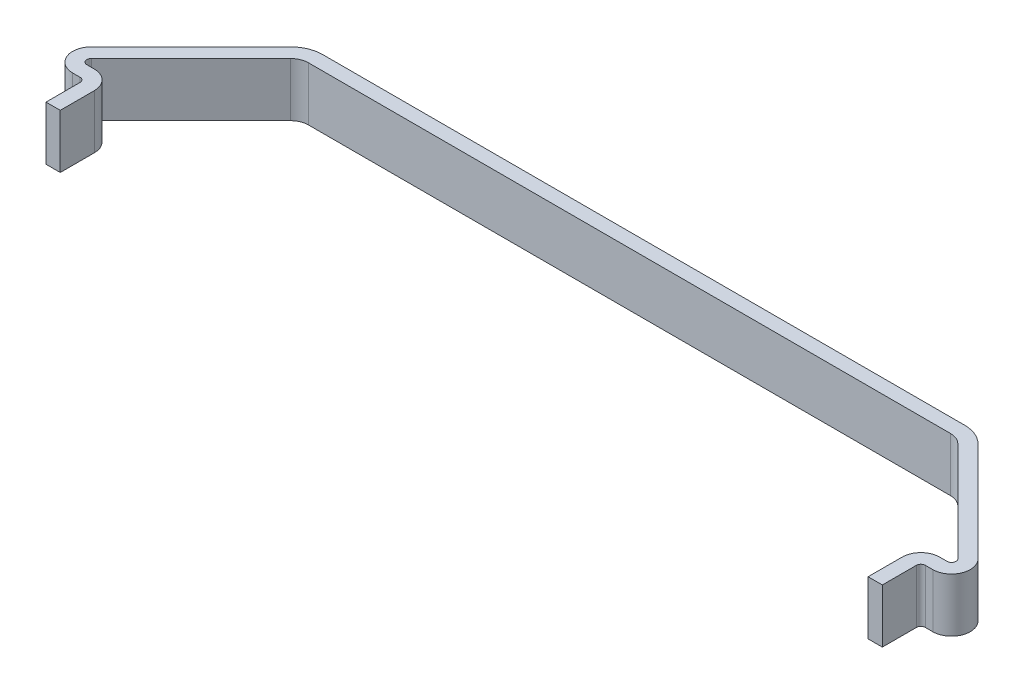
from build123d import *

# Parameters (mm, degrees)
BOSS_EXTRUDE1_DEPTH = 1.5


with BuildPart() as part:
    # Sketch1 → Boss-Extrude1 (new, symmetric)
    with BuildSketch(Plane(origin=(0, 0, 0), x_dir=(1, 0, 0), z_dir=(0, 1, 0))):
        with BuildLine():
            Line((17.879536438, 11.70625), (-17.879536438, 11.70625))
            ThreePointArc((-17.879536438, 11.70625), (-18.26221987, 11.630129533), (-18.586643219, 11.413356781))
            Line((-18.586643219, 11.413356781), (-24.133026695, 5.866973305))
            ThreePointArc((-24.133026695, 5.866973305), (-24.187219883, 5.594525751), (-23.95625, 5.440196609))
            Line((-23.95625, 5.440196609), (-23.54375, 5.440196609))
            ThreePointArc((-23.54375, 5.440196609), (-22.805707297, 5.134489312), (-22.5, 4.396446609))
            Line((-22.5, 4.396446609), (-22.5, 2.5))
            Line((-22.5, 2.5), (-23.29375, 2.5))
            Line((-23.29375, 2.5), (-23.29375, 4.396446609))
            ThreePointArc((-23.29375, 4.396446609), (-23.366973305, 4.573223305), (-23.54375, 4.646446609))
            Line((-23.54375, 4.646446609), (-23.95625, 4.646446609))
            ThreePointArc((-23.95625, 4.646446609), (-24.920549262, 5.290770777), (-24.694292703, 6.428239312))
            Line((-24.694292703, 6.428239312), (-19.147909226, 11.974622789))
            ThreePointArc((-19.147909226, 11.974622789), (-18.565974844, 12.363458911), (-17.879536438, 12.5))
            Line((-17.879536438, 12.5), (17.879536438, 12.5))
            ThreePointArc((17.879536438, 12.5), (18.565974844, 12.363458911), (19.147909226, 11.974622789))
            Line((19.147909226, 11.974622789), (24.694292703, 6.428239312))
            ThreePointArc((24.694292703, 6.428239312), (24.920549262, 5.290770777), (23.95625, 4.646446609))
            Line((23.95625, 4.646446609), (23.54375, 4.646446609))
            ThreePointArc((23.54375, 4.646446609), (23.366973305, 4.573223305), (23.29375, 4.396446609))
            Line((23.29375, 4.396446609), (23.29375, 2.5))
            Line((23.29375, 2.5), (22.5, 2.5))
            Line((22.5, 2.5), (22.5, 4.396446609))
            ThreePointArc((22.5, 4.396446609), (22.805707297, 5.134489312), (23.54375, 5.440196609))
            Line((23.54375, 5.440196609), (23.95625, 5.440196609))
            ThreePointArc((23.95625, 5.440196609), (24.187219883, 5.594525751), (24.133026695, 5.866973305))
            Line((24.133026695, 5.866973305), (18.586643219, 11.413356781))
            ThreePointArc((18.586643219, 11.413356781), (18.26221987, 11.630129533), (17.879536438, 11.70625))
        make_face()
    extrude(amount=BOSS_EXTRUDE1_DEPTH, both=True)


solid = part.part
